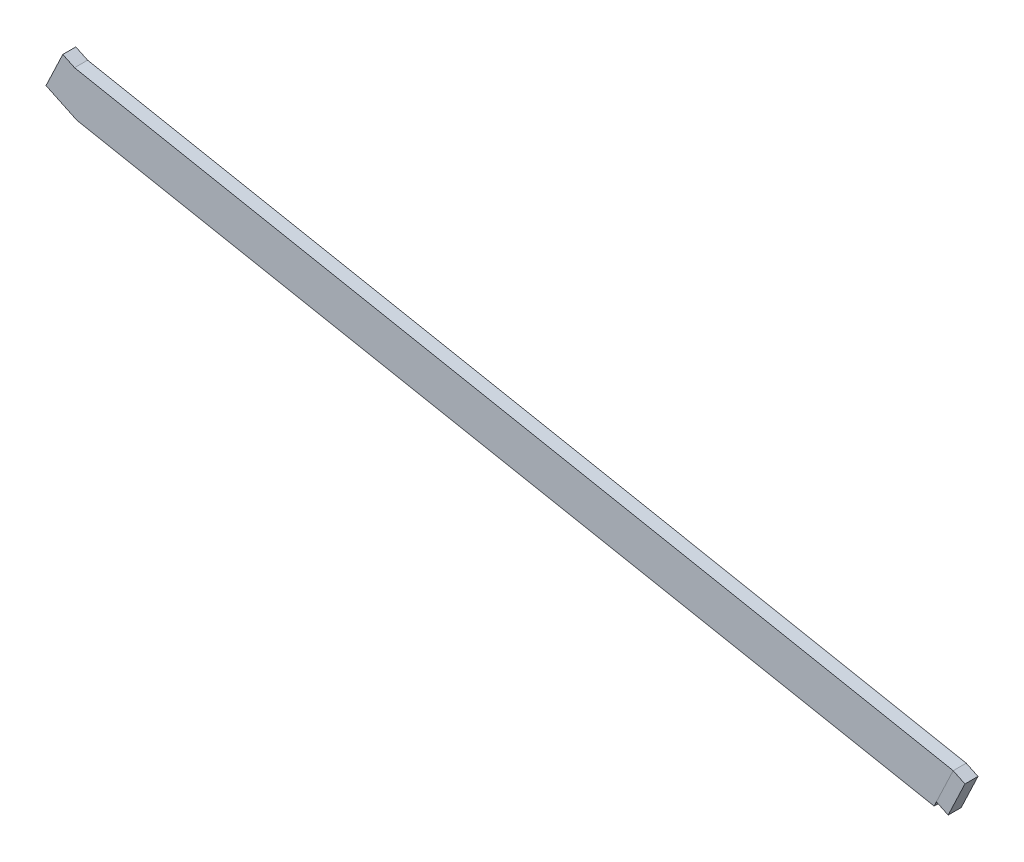
from build123d import *

# Parameters (mm, degrees)
BOSS_EXTRUDE1_DEPTH = 3.175
CUT_EXTRUDE1_DEPTH  = 238.449079666
CUT_EXTRUDE2_DEPTH  = 238.449079666
CUT_EXTRUDE3_DEPTH  = 238.449079666
BOSS_EXTRUDE2_DEPTH = 3.175


with BuildPart() as part:
    # Sketch1 → Boss-Extrude1 (new body)
    with BuildSketch(Plane.XY):
        Polygon((233.689675114, 19.05), (0, 19.05), (-2.639109482, 20.301935358), (-6.721507389, 11.696143569), (-4.082397907, 10.44420821), (-7.376853836, 3.499416834), (0, 0), (224.652775078, 0), (224.700845079, 0.101332705), (116.204157045, 1.003029976), (116.204399748, 1.032233261), (224.714645025, 0.130423318), (229.607277207, 10.44420821), (232.47587447, 9.083408908), (236.558272377, 17.689200698), align=None)
    extrude(amount=BOSS_EXTRUDE1_DEPTH)

    # Sketch2 → Cut-Extrude1 (cut, through all)
    with BuildSketch(Plane.XY.offset(3.175)):
        Polygon((-7.376853836, 9.525), (-7.376853836, 0), (236.558272377, 0), (236.558272377, 4.7625), (229.171225096, 9.525), align=None)
    extrude(amount=-CUT_EXTRUDE1_DEPTH, mode=Mode.SUBTRACT)

    # Sketch3 → Cut-Extrude2 (cut, through all)
    with BuildSketch(Plane.XY.offset(3.175)):
        Polygon((-4.082397907, 10.44420821), (-4.518450018, 9.525), (-2.144685159, 9.525), align=None)
    extrude(amount=-CUT_EXTRUDE2_DEPTH, mode=Mode.SUBTRACT)

    # Sketch4 → Cut-Extrude3 (cut, through all)
    with BuildSketch(Plane.XY.offset(3.175)):
        Polygon((-6.721507389, 11.696143569), (40.288847635, 110.795088966), (233.689675114, 19.05), (186.679320089, -80.048945397), align=None)
    extrude(amount=-CUT_EXTRUDE3_DEPTH, mode=Mode.SUBTRACT)


with BuildPart() as body_2:
    # Sketch5 → Boss-Extrude2 (new body)
    with BuildSketch(Plane.XY.offset(3.175)):
        Polygon((233.689675114, 19.05), (19.849708932, 60.30093938), (16.981111669, 61.661738682), (12.898713762, 53.055946892), (20.357066646, 49.517868706), (229.045813198, 9.260628739), (229.607277207, 10.44420821), align=None)
    extrude(amount=-BOSS_EXTRUDE2_DEPTH)


solid = Compound([part.part, body_2.part])
